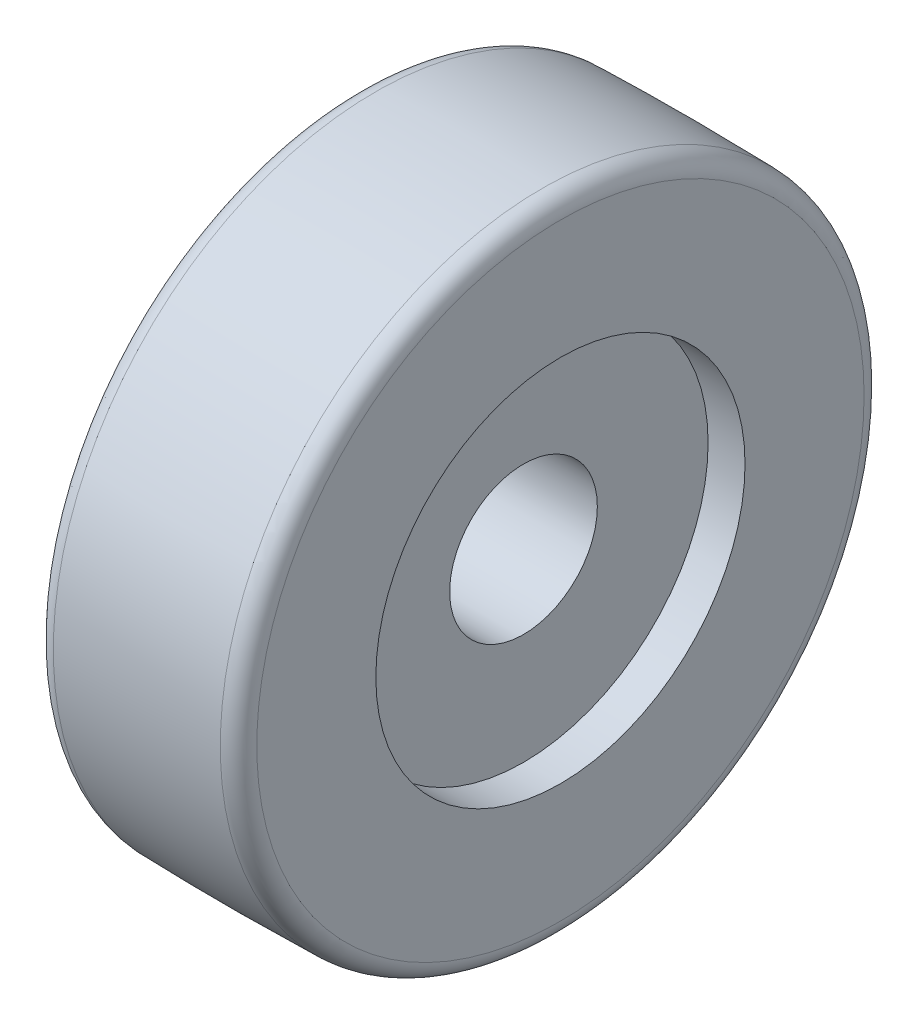
from build123d import *


with BuildPart() as part:
    # Sketch1 → Revolve1 (revolve)
    with BuildSketch(Plane.XY, mode=Mode.PRIVATE) as revolve1_sk:
        with BuildLine():
            Line((-5.5, 16.449114097), (-5.5, 10))
            Line((-5.5, 10), (-3.5, 10))
            Line((-3.5, 10), (-3.5, 4))
            Line((-3.5, 4), (3.5, 4))
            Line((3.5, 4), (3.5, 10))
            Line((3.5, 10), (5.5, 10))
            Line((5.5, 10), (5.5, 16.449114097))
            ThreePointArc((5.5, 16.449114097), (5.215057014, 17.148180237), (4.522613065, 17.448858389))
            ThreePointArc((4.522613065, 17.448858389), (0, 17.5), (-4.522613065, 17.448858389))
            ThreePointArc((-4.522613065, 17.448858389), (-5.215057014, 17.148180237), (-5.5, 16.449114097))
        make_face()
    revolve(revolve1_sk.sketch.rotate(Axis((-5.5, 0, 0), (1, 0, 0)), 270), axis=Axis((-5.5, 0, 0), (1, 0, 0)))


solid = part.part
